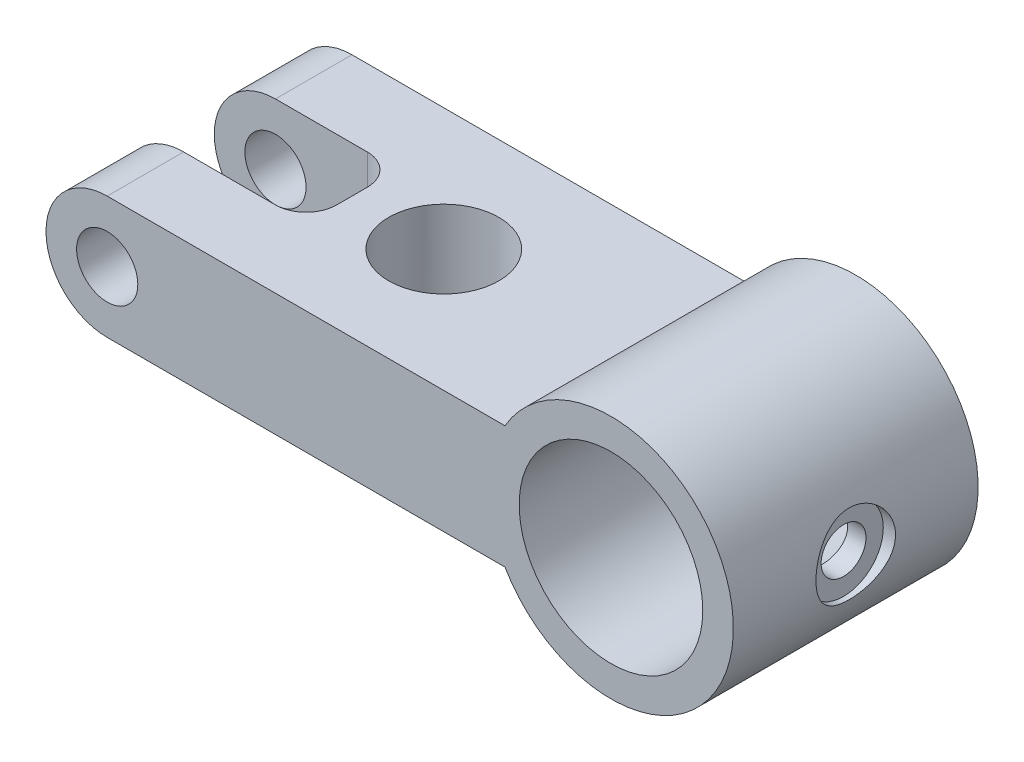
from build123d import *

# Parameters (mm, degrees)
SKETCH1_R                      = 1.27
SKETCH1_R_2                    = 3.81
BOSS_EXTRUDE1_DEPTH            = 5.08
F_15_0_18_DIAMETER_HOLE1_D     = 4.572
SKETCH5_W                      = 15.24
SKETCH5_H                      = 3.81
CUT_EXTRUDE1_DEPTH             = 5.08
FILLET1_R                      = 1.27
CUT_EXTRUDE3_START             = 5.334
SKETCH8_R                      = 1.651
CUT_EXTRUDE3_DEPTH             = 0.762
SCALE1_SCALE                   = 1.5
F_35_0_11_DIAMETER_HOLE1_D     = 2.794
F_35_0_11_DIAMETER_HOLE1_DEPTH = 6.35
F_35_0_11_DIAMETER_HOLE1_TIP   = 0.839402285


with BuildPart() as part:
    # Sketch1 → Boss-Extrude1 (new, symmetric)
    with BuildSketch(Plane.XY):
        with BuildLine():
            Line((-20.909409051, -2.54), (-4.399409051, -2.54))
            ThreePointArc((-4.399409051, -2.54), (5.08, 0), (-4.399409051, 2.54))
            Line((-4.399409051, 2.54), (-20.909409051, 2.54))
            ThreePointArc((-20.909409051, 2.54), (-23.449409051, 0), (-20.909409051, -2.54))
        make_face()
        with Locations((-20.909409051, 0)):
            Circle(SKETCH1_R, mode=Mode.SUBTRACT)
        Circle(SKETCH1_R_2, mode=Mode.SUBTRACT)
    extrude(amount=BOSS_EXTRUDE1_DEPTH, both=True)

    # #15 (0.18) Diameter Hole1 (through all)
    with Locations(Plane(origin=(0, 2.54, 0), x_dir=(1, 0, 0), z_dir=(0, 1, 0))):
        with Locations((-12.019409051, 0)):
            Hole(F_15_0_18_DIAMETER_HOLE1_D / 2)

    # Sketch5 → Cut-Extrude1 (cut)
    with BuildSketch(Plane(origin=(0, 2.54, 0), x_dir=(1, 0, 0), z_dir=(0, 1, 0))):
        with Locations((-23.449409051, 0)):
            Rectangle(SKETCH5_W, SKETCH5_H)
    extrude(amount=-CUT_EXTRUDE1_DEPTH, mode=Mode.SUBTRACT)

    # Fillet1
    fillet1_edges = [part.edges().sort_by_distance(p)[0] for p in [
        (-15.829409051, 0, 1.905),
        (-15.829409051, 0, -1.905),
    ]]
    fillet(fillet1_edges, radius=FILLET1_R)

    # Sketch8 → Cut-Extrude3 (cut)
    with BuildSketch(Plane(origin=(0, 0, 0), x_dir=(0, 0, -1), z_dir=(1, 0, 0)).offset(CUT_EXTRUDE3_START)):
        Circle(SKETCH8_R)
    extrude(amount=-CUT_EXTRUDE3_DEPTH, mode=Mode.SUBTRACT)


with BuildPart() as part_1:
    # Scale1: scaled about (-8.355295552, 4.7607e-05, -6.308e-06)
    add(part.part.scale(SCALE1_SCALE).moved(Location((4.177647776, -2.3804e-05, 3.154e-06))))

    # #35 (0.11) Diameter Hole1
    with Locations(Plane(origin=(11.035535864, 0, 0), x_dir=(0, 0, -1), z_dir=(1, 0, 0))):
        with Locations((0, 0)):
            Hole(F_35_0_11_DIAMETER_HOLE1_D / 2, depth=F_35_0_11_DIAMETER_HOLE1_DEPTH)
            with Locations((0, 0, -(F_35_0_11_DIAMETER_HOLE1_DEPTH + F_35_0_11_DIAMETER_HOLE1_TIP / 2))):  # 118° drill point
                Cone(0, F_35_0_11_DIAMETER_HOLE1_D / 2, F_35_0_11_DIAMETER_HOLE1_TIP, mode=Mode.SUBTRACT)


solid = part_1.part
